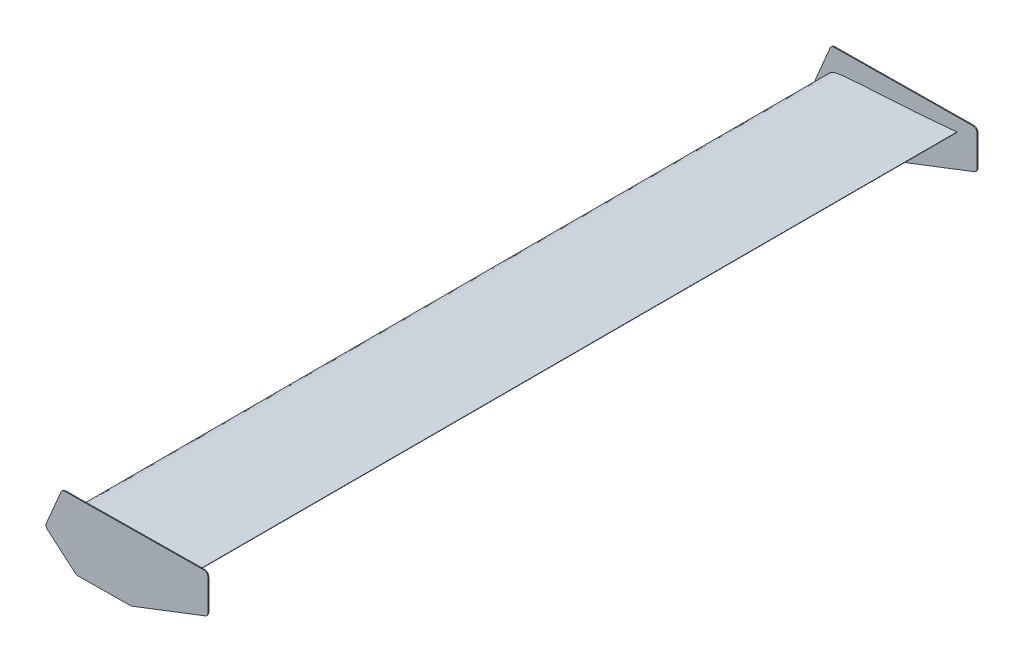
from build123d import *

# Parameters (mm, degrees)
REAR_WING_DEPTH              = 900
ENDPLATE_DEPTH               = 1
ENDPLATE_FILLET_R            = 10
ENDPLATE_FILLET_OF_MIRROR3_R = 10


with BuildPart() as part:
    # AirfoilSketch → Rear Wing (new, symmetric)
    with BuildSketch(Plane.XY):
        with BuildLine():
            Line((298.356820722, 31.358565478), (298.43734441, 30.582733064))
            add(Edge.make_bspline(
                [(298.43734441, 30.582733064), (293.609557546, 28.7146432), (283.97728208, 24.987478629), (264.629218664, 18.020201223), (240.35962695, 10.022011513), (211.045803027, 1.578300893), (181.655129619, -5.899482853), (152.117488337, -12.123204167), (122.460420542, -17.170931851), (97.535550352, -19.777805195), (77.489905907, -20.466573629), (62.354447913, -20.204271879), (47.097324908, -19.084354062), (34.350468252, -17.156062374), (24.066096839, -14.93981176), (16.247371128, -12.65138518), (9.503363179, -9.998850946), (3.536585211, -6.607967721), (-1.961349467, -0.728967593), (2.751617668, 4.692736733), (7.878743356, 7.161088807), (14.087382266, 9.112338535), (21.510023521, 10.547176419), (31.420148338, 12.045987174), (43.864226448, 13.302337538), (58.830785064, 14.433617478), (73.825998825, 15.186264815), (93.815781007, 16.320591739), (118.801974892, 17.70710611), (148.76366845, 19.683633491), (178.72862232, 21.535377435), (208.677274935, 23.571983524), (238.599215851, 25.889232116), (263.508923945, 28.074343444), (283.429423188, 29.878295571), (293.381111101, 30.865151057), (298.356820722, 31.358565478)],
                knots=[0, 0, 0, 0, 0.025304886, 0.050487653, 0.100520433, 0.150190716, 0.199586607, 0.248740009, 0.297715539, 0.346600594, 0.371102737, 0.395726297, 0.420570145, 0.445825119, 0.458702216, 0.471919982, 0.485786003, 0.493461051, 0.506863029, 0.51614777, 0.522766003, 0.535269014, 0.547551134, 0.559786371, 0.584228898, 0.60868081, 0.633151284, 0.657621757, 0.706558114, 0.75548187, 0.804405627, 0.853320224, 0.902221408, 0.951113136, 0.975557228, 1, 1, 1, 1], degree=3))
        make_face()
    extrude(amount=REAR_WING_DEPTH, both=True)

    # Endplate Sketch → Endplate (add, symmetric)
    with BuildSketch(Plane.XY.offset(900)):
        Polygon((4.198364617, 59.406656961), (-35.29092082, -33.850525596), (38.257501257, -96.733844985), (166.27509038, -95.421105135), (345.667321655, -26.31860721), (345.667321655, 62.908206322), align=None)
    endplate = extrude(amount=ENDPLATE_DEPTH, both=True)

    # Endplate Fillet
    endplate_fillet_edges = [part.edges().sort_by_distance(p)[0] for p in [
        (345.667321655, 62.908206322, 900),
        (4.198364617, 59.406656961, 900),
        (-35.29092082, -33.850525596, 900),
        (38.257501257, -96.733844985, 900),
        (166.27509038, -95.421105135, 900),
        (345.667321655, -26.31860721, 900),
    ]]
    fillet(endplate_fillet_edges, radius=ENDPLATE_FILLET_R)

    # Mirror3: Endplate across plane
    add(endplate.mirror(Plane.XY))

    # Endplate Fillet of Mirror3
    endplate_fillet_of_mirror3_edges = [part.edges().sort_by_distance(p)[0] for p in [
        (345.667321655, 62.908206322, -900),
        (4.198364617, 59.406656961, -900),
        (-35.29092082, -33.850525596, -900),
        (38.257501257, -96.733844985, -900),
        (166.27509038, -95.421105135, -900),
        (345.667321655, -26.31860721, -900),
    ]]
    fillet(endplate_fillet_of_mirror3_edges, radius=ENDPLATE_FILLET_OF_MIRROR3_R)


solid = part.part
